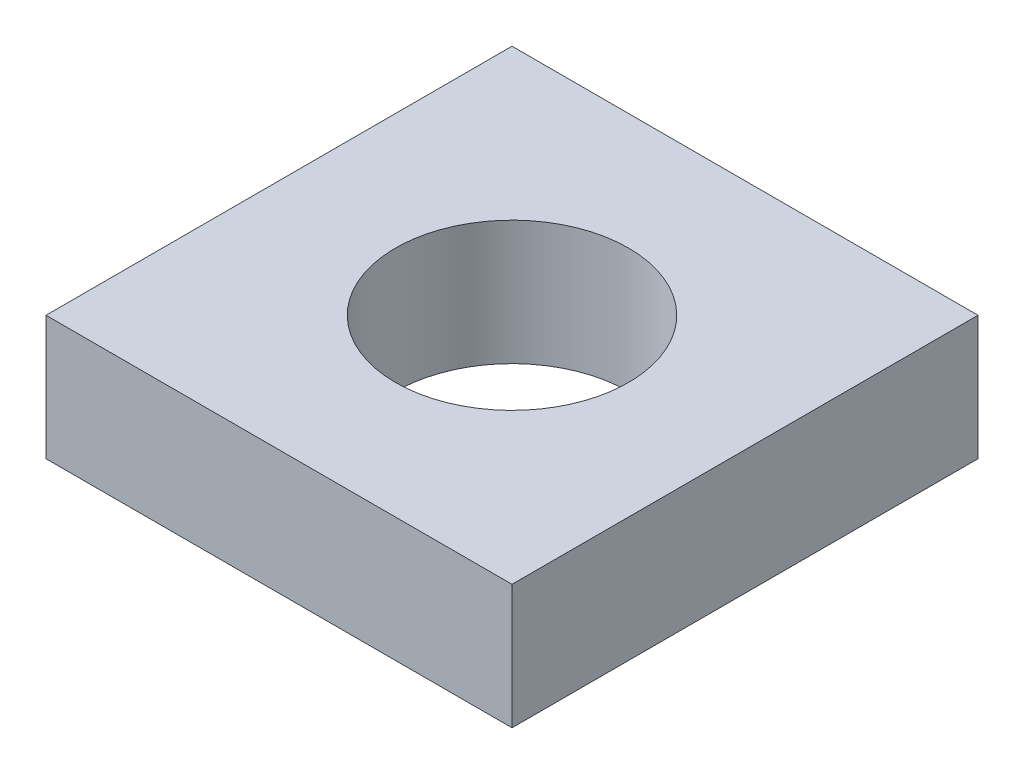
from build123d import *

# Parameters (mm, degrees)
SKETCH1_W           = 6
SKETCH1_H           = 6
SKETCH1_R           = 1.5
BOSS_EXTRUDE1_DEPTH = 1.6


with BuildPart() as part:
    # Sketch1 → Boss-Extrude1 (new body)
    with BuildSketch(Plane(origin=(0, 0, 0), x_dir=(1, 0, 0), z_dir=(0, 1, 0))):
        Rectangle(SKETCH1_W, SKETCH1_H)
        with Locations(Location((0, 0, 0), (0, 0, 270))):
            Circle(SKETCH1_R, mode=Mode.SUBTRACT)
    extrude(amount=BOSS_EXTRUDE1_DEPTH)


solid = part.part
